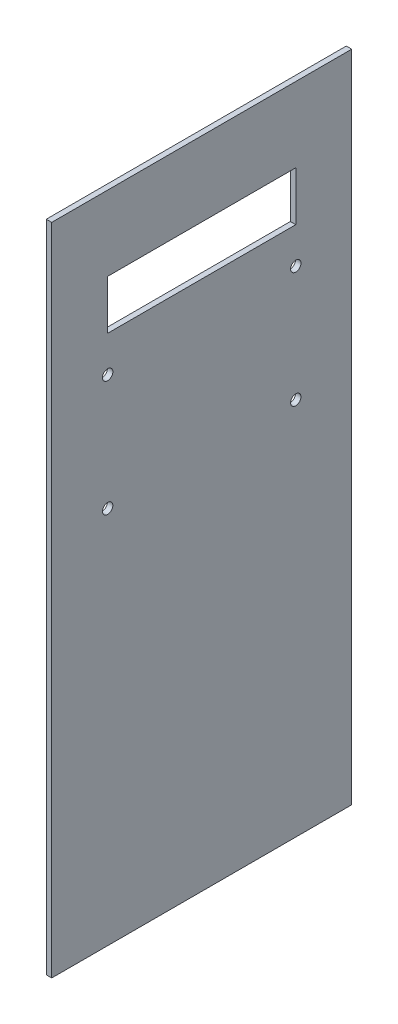
from build123d import *

# Parameters (mm, degrees)
SKETCH1_W           = 174.91964
SKETCH1_H           = 381.5334
SKETCH1_R           = 3.015623361
SKETCH1_W_2         = 109.668996446
SKETCH1_H_2         = 28.739233449
BOSS_EXTRUDE1_DEPTH = 3.175


with BuildPart() as part:
    # Sketch1 → Boss-Extrude1 (new body)
    with BuildSketch(Plane(origin=(0, 0, 0), x_dir=(0, 0, -1), z_dir=(1, 0, 0))):
        Rectangle(SKETCH1_W, SKETCH1_H)
        with Locations((-54.834498223, 97.534188116)):
            Circle(SKETCH1_R, mode=Mode.SUBTRACT)
        with Locations((54.834498223, 97.534188116)):
            Circle(SKETCH1_R, mode=Mode.SUBTRACT)
        with Locations((54.834498223, 30.034188116)):
            Circle(SKETCH1_R, mode=Mode.SUBTRACT)
        with Locations((-54.834498223, 30.034188116)):
            Circle(SKETCH1_R, mode=Mode.SUBTRACT)
        with Locations((0, 132.82288111)):
            Rectangle(SKETCH1_W_2, SKETCH1_H_2, mode=Mode.SUBTRACT)
    extrude(amount=BOSS_EXTRUDE1_DEPTH)


solid = part.part
